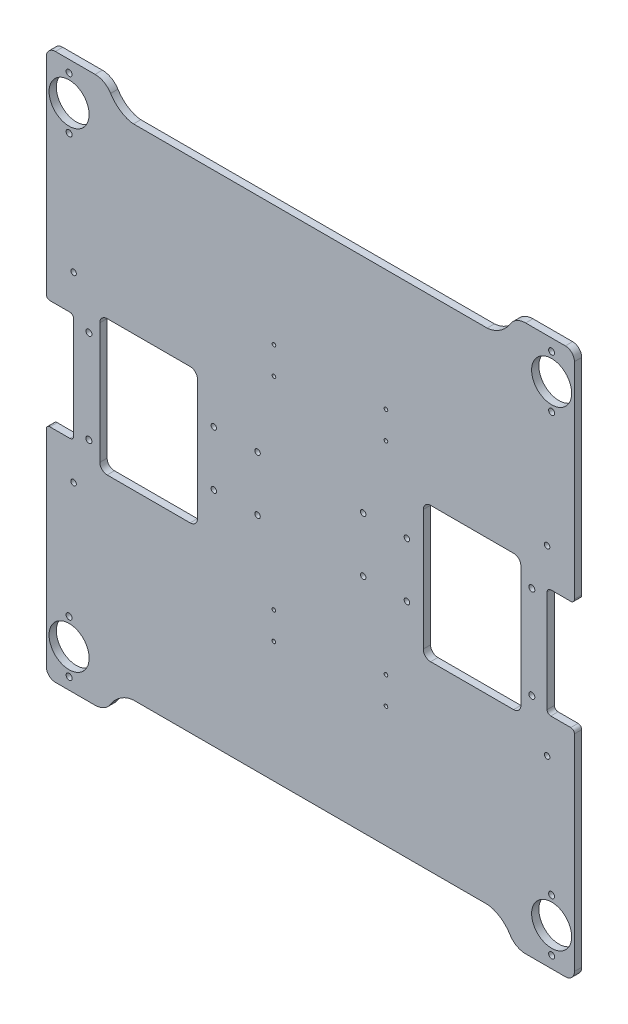
from build123d import *

# Parameters (mm, degrees)
SKETCH2_R           = 1.65
SKETCH2_R_2         = 11
SKETCH2_R_3         = 1.5
SKETCH2_R_4         = 1
BOSS_EXTRUDE1_DEPTH = 4


with BuildPart() as part:
    # Sketch2 → Boss-Extrude1 (new body)
    with BuildSketch(Plane.XY):
        with BuildLine():
            Line((-140, 175), (-118.205067931, 175))
            ThreePointArc((-118.205067931, 175), (-113.316837275, 173.723829494), (-109.676249776, 170.221040209))
            add(Edge.make_bspline(
                [(-109.676249776, 170.221040209), (-107.076087276, 165.973550773), (-102.14217925, 162.295269988), (-97.095196953, 162)],
                knots=[0.25103648, 0.25103648, 0.25103648, 0.25103648, 1, 1, 1, 1], degree=3))
            Line((-97.095196953, 162), (97.095196953, 162))
            add(Edge.make_bspline(
                [(109.676249776, 170.221040209), (107.076087276, 165.973550773), (102.14217925, 162.295269988), (97.095196953, 162)],
                knots=[0.25103648, 0.25103648, 0.25103648, 0.25103648, 1, 1, 1, 1], degree=3))
            ThreePointArc((109.676249776, 170.221040209), (113.316837275, 173.723829494), (118.205067931, 175))
            Line((118.205067931, 175), (140, 175))
            ThreePointArc((140, 175), (143.535533906, 173.535533906), (145, 170))
            Line((145, 170), (145, 57))
            ThreePointArc((145, 57), (144.414213562, 55.585786438), (143, 55))
            Line((143, 55), (132, 55))
            ThreePointArc((132, 55), (130.585786438, 54.414213562), (130, 53))
            Line((130, 53), (130, -3))
            ThreePointArc((130, -3), (130.585786438, -4.414213562), (132, -5))
            Line((132, -5), (143, -5))
            ThreePointArc((143, -5), (144.414213562, -5.585786438), (145, -7))
            Line((145, -7), (145, -120))
            ThreePointArc((145, -120), (143.535533906, -123.535533906), (140, -125))
            Line((140, -125), (118.205067931, -125))
            ThreePointArc((118.205067931, -125), (113.316837275, -123.723829494), (109.676249776, -120.221040209))
            add(Edge.make_bspline(
                [(109.676249776, -120.221040209), (107.076087276, -115.973550773), (102.14217925, -112.295269988), (97.095196953, -112)],
                knots=[0.25103648, 0.25103648, 0.25103648, 0.25103648, 1, 1, 1, 1], degree=3))
            Line((97.095196953, -112), (-97.095196953, -112))
            add(Edge.make_bspline(
                [(-109.676249776, -120.221040209), (-107.076087276, -115.973550773), (-102.14217925, -112.295269988), (-97.095196953, -112)],
                knots=[0.25103648, 0.25103648, 0.25103648, 0.25103648, 1, 1, 1, 1], degree=3))
            ThreePointArc((-109.676249776, -120.221040209), (-113.316837275, -123.723829494), (-118.205067931, -125))
            Line((-118.205067931, -125), (-140, -125))
            ThreePointArc((-140, -125), (-143.535533906, -123.535533906), (-145, -120))
            Line((-145, -120), (-145, -7))
            ThreePointArc((-145, -7), (-144.414213562, -5.585786438), (-143, -5))
            Line((-143, -5), (-132, -5))
            ThreePointArc((-132, -5), (-130.585786438, -4.414213562), (-130, -3))
            Line((-130, -3), (-130, 53))
            ThreePointArc((-130, 53), (-130.585786438, 54.414213562), (-132, 55))
            Line((-132, 55), (-143, 55))
            ThreePointArc((-143, 55), (-144.414213562, 55.585786438), (-145, 57))
            Line((-145, 57), (-145, 170))
            ThreePointArc((-145, 170), (-143.535533906, 173.535533906), (-140, 175))
        make_face()
        with Locations((-132.473303105, 168.56037538)):
            Circle(SKETCH2_R, mode=Mode.SUBTRACT)
        with Locations((-132.473303105, 139.890769728)):
            Circle(SKETCH2_R, mode=Mode.SUBTRACT)
        with Locations((132.473303105, 168.56037538)):
            Circle(SKETCH2_R, mode=Mode.SUBTRACT)
        with Locations((132.473303105, 139.890769728)):
            Circle(SKETCH2_R, mode=Mode.SUBTRACT)
        with Locations((132.473303105, 154.225572554)):
            Circle(SKETCH2_R_2, mode=Mode.SUBTRACT)
        with Locations((-132.473303105, 154.225572554)):
            Circle(SKETCH2_R_2, mode=Mode.SUBTRACT)
        with Locations((121.59774802, -0.5)):
            Circle(SKETCH2_R, mode=Mode.SUBTRACT)
        with Locations((121.59774802, 50.5)):
            Circle(SKETCH2_R, mode=Mode.SUBTRACT)
        with Locations((-121.59774802, -0.5)):
            Circle(SKETCH2_R, mode=Mode.SUBTRACT)
        with Locations((-121.59774802, 50.5)):
            Circle(SKETCH2_R, mode=Mode.SUBTRACT)
        with Locations((-29, 10)):
            Circle(SKETCH2_R_3, mode=Mode.SUBTRACT)
        with Locations((-29, 40)):
            Circle(SKETCH2_R_3, mode=Mode.SUBTRACT)
        with Locations((-53, 40)):
            Circle(SKETCH2_R_3, mode=Mode.SUBTRACT)
        with Locations((-53, 10)):
            Circle(SKETCH2_R_3, mode=Mode.SUBTRACT)
        with Locations((53, 10)):
            Circle(SKETCH2_R_3, mode=Mode.SUBTRACT)
        with Locations((29, 10)):
            Circle(SKETCH2_R_3, mode=Mode.SUBTRACT)
        with Locations((29, 40)):
            Circle(SKETCH2_R_3, mode=Mode.SUBTRACT)
        with Locations((53, 40)):
            Circle(SKETCH2_R_3, mode=Mode.SUBTRACT)
        with Locations((132.473303105, -118.56037538)):
            Circle(SKETCH2_R, mode=Mode.SUBTRACT)
        with Locations((132.473303105, -89.890769728)):
            Circle(SKETCH2_R, mode=Mode.SUBTRACT)
        with Locations((132.473303105, -104.225572554)):
            Circle(SKETCH2_R_2, mode=Mode.SUBTRACT)
        with Locations((-132.473303105, -104.225572554)):
            Circle(SKETCH2_R_2, mode=Mode.SUBTRACT)
        with Locations((-132.473303105, -89.890769728)):
            Circle(SKETCH2_R, mode=Mode.SUBTRACT)
        with Locations((-132.473303105, -118.56037538)):
            Circle(SKETCH2_R, mode=Mode.SUBTRACT)
        with Locations((130, 75)):
            Circle(SKETCH2_R_3, mode=Mode.SUBTRACT)
        with Locations((41.5, 95.575)):
            Circle(SKETCH2_R_4, mode=Mode.SUBTRACT)
        with Locations((41.5, 80.575)):
            Circle(SKETCH2_R_4, mode=Mode.SUBTRACT)
        with Locations((-20, 80.575)):
            Circle(SKETCH2_R_4, mode=Mode.SUBTRACT)
        with Locations((-20, 95.575)):
            Circle(SKETCH2_R_4, mode=Mode.SUBTRACT)
        with Locations((-20, -45.575)):
            Circle(SKETCH2_R_4, mode=Mode.SUBTRACT)
        with Locations((-20, -30.575)):
            Circle(SKETCH2_R_4, mode=Mode.SUBTRACT)
        with Locations((41.5, -30.575)):
            Circle(SKETCH2_R_4, mode=Mode.SUBTRACT)
        with Locations((41.5, -45.575)):
            Circle(SKETCH2_R_4, mode=Mode.SUBTRACT)
        with Locations((130, -25)):
            Circle(SKETCH2_R_3, mode=Mode.SUBTRACT)
        with Locations((-130, 75)):
            Circle(SKETCH2_R_3, mode=Mode.SUBTRACT)
        with Locations((-130, -25)):
            Circle(SKETCH2_R_3, mode=Mode.SUBTRACT)
        with BuildLine():
            Line((-66, 62.171403079), (-111.59774802, 62.171403079))
            ThreePointArc((-111.59774802, 62.171403079), (-114.426175145, 60.999830204), (-115.59774802, 58.171403079))
            Line((-115.59774802, 58.171403079), (-115.59774802, -8.171403079))
            ThreePointArc((-115.59774802, -8.171403079), (-114.426175145, -10.999830204), (-111.59774802, -12.171403079))
            Line((-111.59774802, -12.171403079), (-66, -12.171403079))
            ThreePointArc((-66, -12.171403079), (-63.171572875, -10.999830204), (-62, -8.171403079))
            Line((-62, -8.171403079), (-62, 58.171403079))
            ThreePointArc((-62, 58.171403079), (-63.171572875, 60.999830204), (-66, 62.171403079))
        make_face(mode=Mode.SUBTRACT)
        with BuildLine():
            Line((66, 62.171403079), (111.59774802, 62.171403079))
            ThreePointArc((111.59774802, 62.171403079), (114.426175145, 60.999830204), (115.59774802, 58.171403079))
            Line((115.59774802, 58.171403079), (115.59774802, -8.171403079))
            ThreePointArc((115.59774802, -8.171403079), (114.426175145, -10.999830204), (111.59774802, -12.171403079))
            Line((111.59774802, -12.171403079), (66, -12.171403079))
            ThreePointArc((66, -12.171403079), (63.171572875, -10.999830204), (62, -8.171403079))
            Line((62, -8.171403079), (62, 58.171403079))
            ThreePointArc((62, 58.171403079), (63.171572875, 60.999830204), (66, 62.171403079))
        make_face(mode=Mode.SUBTRACT)
    extrude(amount=BOSS_EXTRUDE1_DEPTH)


solid = part.part
